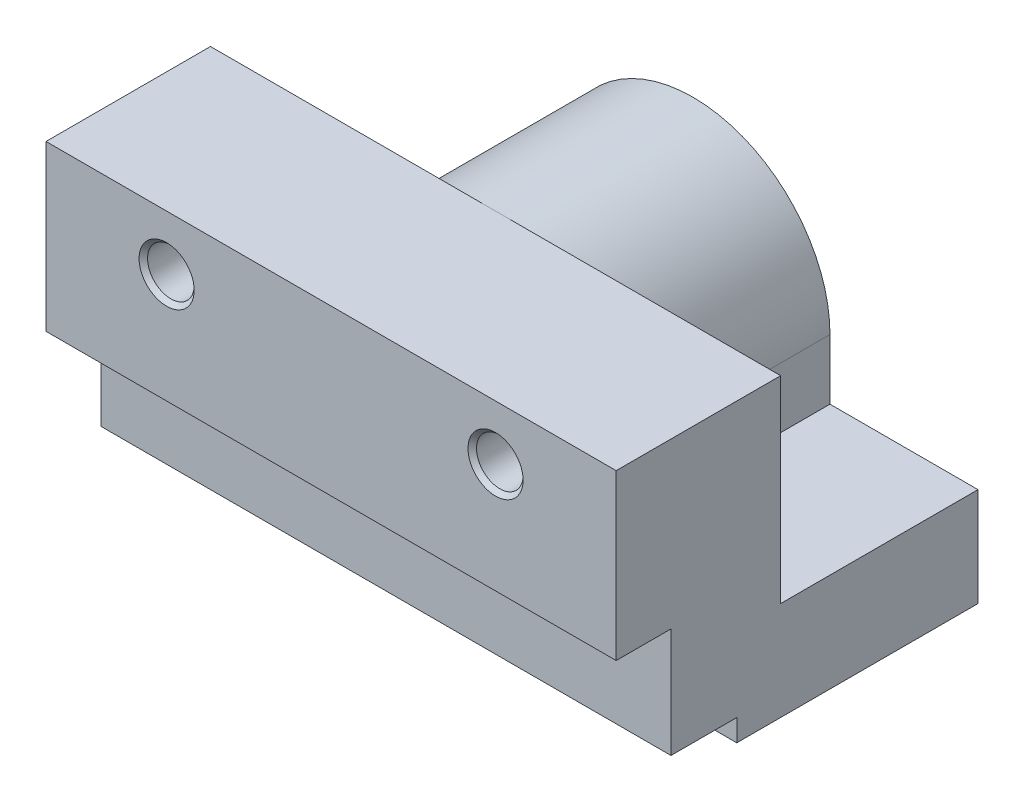
from build123d import *

# Parameters (mm, degrees)
CROQUIS2_W                                = 104
CROQUIS2_H                                = 54
SALIENTE_EXTRUIR1_DEPTH                   = 66
CORTAR_EXTRUIR1_DEPTH                     = 36
TALADROS_DE_ESPIGA_DE_16_0MM1_D           = 16
TALADROS_DE_ESPIGA_DE_16_0MM1_DEPTH       = 36
TALADROS_DE_ESPIGA_DE_16_0MM1_CSINK_D     = 16.05
TALADROS_DE_ESPIGA_DE_16_0MM1_CSINK_ANGLE = 90
TALADROS_DE_ESPIGA_DE_16_0MM1_TIP         = 4.806884952
CROQUIS7_W                                = 28
CROQUIS7_H                                = 44
SALIENTE_EXTRUIR2_DEPTH                   = 4
CORTAR_EXTRUIR3_DEPTH                     = 100.879927913
CORTAR_EXTRUIR3_DEPTH_BACK                = 100.879927913
CORTAR_EXTRUIR4_DEPTH                     = 100.879927913
CORTAR_EXTRUIR4_DEPTH_BACK                = 100.879927913
CROQUIS9_R                                = 2
TALADRO_ROSCADO_M102_D                    = 8.5
TALADRO_ROSCADO_M102_DEPTH                = 27.5
TALADRO_ROSCADO_M102_CSINK_D              = 10.05
TALADRO_ROSCADO_M102_CSINK_ANGLE          = 90
TALADRO_ROSCADO_M102_TIP                  = 2.553657631


with BuildPart() as part:
    # Croquis2 → Saliente-Extruir1 (new body)
    with BuildSketch(Plane.XY):
        with Locations((0, 27)):
            Rectangle(CROQUIS2_W, CROQUIS2_H)
    extrude(amount=SALIENTE_EXTRUIR1_DEPTH)

    # Croquis3 → Cortar-Extruir1 (cut)
    with BuildSketch(Plane.XY):
        with BuildLine():
            Line((25, 29), (25, 18))
            Line((25, 18), (52, 18))
            Line((52, 18), (52, 54))
            Line((52, 54), (0, 54))
            ThreePointArc((0, 54), (17.67766953, 46.67766953), (25, 29))
        make_face()
    cortar_extruir1 = extrude(amount=CORTAR_EXTRUIR1_DEPTH, mode=Mode.SUBTRACT)

    # Simetría1: Cortar-Extruir1 across plane
    add(cortar_extruir1.mirror(Plane(origin=(0, 0, 0), x_dir=(0, 0, 1), z_dir=(1, 0, 0))), mode=Mode.SUBTRACT)

    # Taladros de espiga de Ø16.0mm1
    with Locations(Plane(origin=(0, 0, 0), x_dir=(-1, 0, 0), z_dir=(0, 0, -1))):
        with Locations((0, 28)):
            CounterSinkHole(TALADROS_DE_ESPIGA_DE_16_0MM1_D / 2, TALADROS_DE_ESPIGA_DE_16_0MM1_CSINK_D / 2, depth=TALADROS_DE_ESPIGA_DE_16_0MM1_DEPTH, counter_sink_angle=TALADROS_DE_ESPIGA_DE_16_0MM1_CSINK_ANGLE)
            with Locations((0, 0, -(TALADROS_DE_ESPIGA_DE_16_0MM1_DEPTH + TALADROS_DE_ESPIGA_DE_16_0MM1_TIP / 2))):  # 118° drill point
                Cone(0, TALADROS_DE_ESPIGA_DE_16_0MM1_D / 2, TALADROS_DE_ESPIGA_DE_16_0MM1_TIP, mode=Mode.SUBTRACT)

    # Croquis7 → Saliente-Extruir2 (add)
    with BuildSketch(Plane(origin=(0, 0, 0), x_dir=(1, 0, 0), z_dir=(0, 1, 0))):
        with Locations((0, -22)):
            Rectangle(CROQUIS7_W, CROQUIS7_H)
    extrude(amount=-SALIENTE_EXTRUIR2_DEPTH)

    # Croquis8 → Cortar-Extruir3 (cut, two sides: drawn at the far end of the back side and taken through both)
    with BuildSketch(Plane(origin=(0, 0, 0), x_dir=(0, 0, -1), z_dir=(1, 0, 0)).offset(-CORTAR_EXTRUIR3_DEPTH_BACK)):
        Polygon((-44, 0), (-56.494918643, 0), (-66, 0), (-66, 24), (-56, 24), (-56, 4), (-44, 4), align=None)
    extrude(amount=CORTAR_EXTRUIR3_DEPTH + CORTAR_EXTRUIR3_DEPTH_BACK, mode=Mode.SUBTRACT)

    # Croquis9 → Cortar-Extruir4 (cut, two sides: drawn at the far end of the back side and taken through both)
    with BuildSketch(Plane(origin=(0, 0, 0), x_dir=(0, 0, -1), z_dir=(1, 0, 0)).offset(-CORTAR_EXTRUIR4_DEPTH_BACK)):
        with Locations((-18, 29)):
            Circle(CROQUIS9_R)
    extrude(amount=CORTAR_EXTRUIR4_DEPTH + CORTAR_EXTRUIR4_DEPTH_BACK, mode=Mode.SUBTRACT)

    # Croquis13 → Taladro roscado M101 (revolve, cut)
    with BuildSketch(Plane(origin=(30, 44, 66), x_dir=(0, -1, 0), z_dir=(1, 0, 0))):
        Polygon((0, 0), (0, 11.553657631), (4.25, 9), (4.25, 0.775), (5.025, 0), align=None)
    taladro_roscado_m101 = revolve(axis=Axis((30, 44, 72.35), (0, 0, -1)), mode=Mode.SUBTRACT)

    # Simetría2: Taladro roscado M101 across plane
    add(taladro_roscado_m101.mirror(Plane.ZY), mode=Mode.SUBTRACT)

    # Taladro roscado M102
    with Locations(Plane(origin=(0, -4, 0), x_dir=(-1, 0, 0), z_dir=(0, -1, 0))):
        with Locations((0, -36), (0, -14)):
            CounterSinkHole(TALADRO_ROSCADO_M102_D / 2, TALADRO_ROSCADO_M102_CSINK_D / 2, depth=TALADRO_ROSCADO_M102_DEPTH, counter_sink_angle=TALADRO_ROSCADO_M102_CSINK_ANGLE)
            with Locations((0, 0, -(TALADRO_ROSCADO_M102_DEPTH + TALADRO_ROSCADO_M102_TIP / 2))):  # 118° drill point
                Cone(0, TALADRO_ROSCADO_M102_D / 2, TALADRO_ROSCADO_M102_TIP, mode=Mode.SUBTRACT)


solid = part.part
